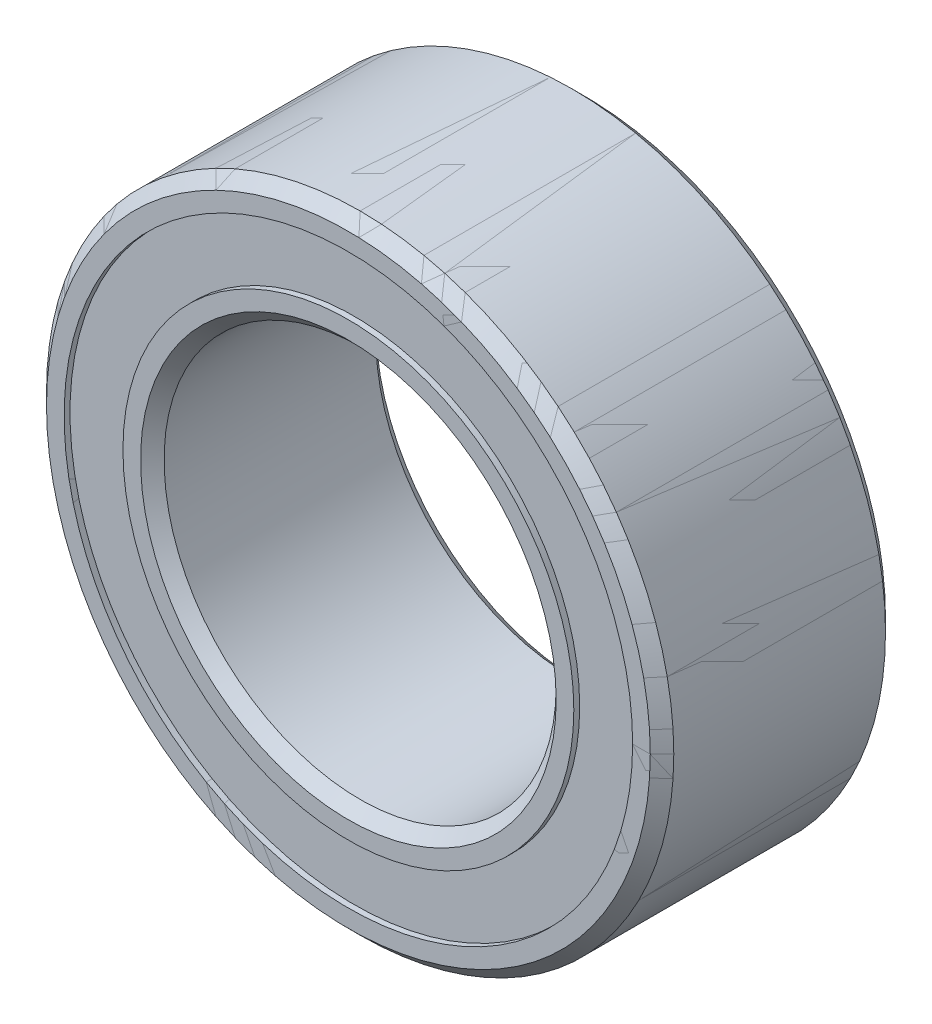
from build123d import *

# Parameters (mm, degrees)
CHAMFER1_SIZE     = 0.15
CIRPATTERN1_COUNT = 11
SKETCH5_W         = 0.925
SKETCH5_H         = 0.75


with BuildPart() as part:
    # Sketch8 → Revolve1 (revolve)
    with BuildSketch(Plane(origin=(0, 0, 0), x_dir=(0, 0, -1), z_dir=(1, 0, 0))):
        with BuildLine():
            Line((1.5, 4), (-1.5, 4))
            Line((-1.5, 4), (-1.5, 3.625))
            Line((-1.5, 3.625), (-0.330718914, 3.625))
            ThreePointArc((-0.330718914, 3.625), (0, 3.75), (0.330718914, 3.625))
            Line((0.330718914, 3.625), (1.5, 3.625))
            Line((1.5, 3.625), (1.5, 4))
        make_face()
    revolve(axis=Axis((0, 0, 1.5), (0, 0, -1)))

    # Chamfer1
    chamfer1_edges = [part.edges().sort_by_distance(p)[0] for p in [
        (0, -4, -1.5),
        (0, -4, 1.5),
    ]]
    chamfer(chamfer1_edges, length=CHAMFER1_SIZE)


with BuildPart() as body_2:
    # Sketch2 → Revolve2 (revolve)
    with BuildSketch(Plane(origin=(0, 0, 0), x_dir=(0, 0, -1), z_dir=(1, 0, 0))):
        with BuildLine():
            Line((-0.330718914, 3.625), (-1.5, 3.625))
            Line((-1.5, 3.625), (-1.5, 3.85))
            Line((-1.5, 3.85), (-1.35, 4))
            Line((-1.35, 4), (1.35, 4))
            Line((1.35, 4), (1.5, 3.85))
            Line((1.5, 3.85), (1.5, 3.625))
            Line((1.5, 3.625), (0.330718914, 3.625))
            ThreePointArc((0.330718914, 3.625), (0, 3.75), (-0.330718914, 3.625))
        make_face()
        with BuildLine():
            Line((1.5, 2.875), (0.330718914, 2.875))
            ThreePointArc((0.330718914, 2.875), (0, 2.75), (-0.330718914, 2.875))
            Line((-0.330718914, 2.875), (-1.5, 2.875))
            Line((-1.5, 2.875), (-1.5, 2.65))
            Line((-1.5, 2.65), (-1.35, 2.5))
            Line((-1.35, 2.5), (1.35, 2.5))
            Line((1.35, 2.5), (1.5, 2.65))
            Line((1.5, 2.65), (1.5, 2.875))
        make_face()
    revolve(axis=Axis((0, 0, 1.5), (0, 0, -1)))


with BuildPart() as body_3:
    # Sketch3 → Revolve3 (revolve)
    with BuildSketch(Plane(origin=(0, 0, 0), x_dir=(0, 0, -1), z_dir=(1, 0, 0))):
        with BuildLine():
            Line((-0.5, 3.25), (0.5, 3.25))
            ThreePointArc((0.5, 3.25), (0, 3.75), (-0.5, 3.25))
        make_face()
    revolve(axis=Axis((0, 3.25, 0.5), (0, 0, -1)))


with BuildPart() as cirpattern1_1:
    # CirPattern1: pattern copy
    add(body_3.part.rotate(Axis((0, 0, -1.5), (0, 0, 1)), 1 * 360 / CIRPATTERN1_COUNT))


with BuildPart() as cirpattern1_2:
    # CirPattern1: pattern copy
    add(body_3.part.rotate(Axis((0, 0, -1.5), (0, 0, 1)), 2 * 360 / CIRPATTERN1_COUNT))


with BuildPart() as cirpattern1_3:
    # CirPattern1: pattern copy
    add(body_3.part.rotate(Axis((0, 0, -1.5), (0, 0, 1)), 3 * 360 / CIRPATTERN1_COUNT))


with BuildPart() as cirpattern1_4:
    # CirPattern1: pattern copy
    add(body_3.part.rotate(Axis((0, 0, -1.5), (0, 0, 1)), 4 * 360 / CIRPATTERN1_COUNT))


with BuildPart() as cirpattern1_5:
    # CirPattern1: pattern copy
    add(body_3.part.rotate(Axis((0, 0, -1.5), (0, 0, 1)), 5 * 360 / CIRPATTERN1_COUNT))


with BuildPart() as cirpattern1_6:
    # CirPattern1: pattern copy
    add(body_3.part.rotate(Axis((0, 0, -1.5), (0, 0, 1)), 6 * 360 / CIRPATTERN1_COUNT))


with BuildPart() as cirpattern1_7:
    # CirPattern1: pattern copy
    add(body_3.part.rotate(Axis((0, 0, -1.5), (0, 0, 1)), 7 * 360 / CIRPATTERN1_COUNT))


with BuildPart() as cirpattern1_8:
    # CirPattern1: pattern copy
    add(body_3.part.rotate(Axis((0, 0, -1.5), (0, 0, 1)), 8 * 360 / CIRPATTERN1_COUNT))


with BuildPart() as cirpattern1_9:
    # CirPattern1: pattern copy
    add(body_3.part.rotate(Axis((0, 0, -1.5), (0, 0, 1)), 9 * 360 / CIRPATTERN1_COUNT))


with BuildPart() as cirpattern1_10:
    # CirPattern1: pattern copy
    add(body_3.part.rotate(Axis((0, 0, -1.5), (0, 0, 1)), 10 * 360 / CIRPATTERN1_COUNT))


with BuildPart() as body_14:
    # Sketch5 → Revolve5 (revolve)
    with BuildSketch(Plane(origin=(0, 0, 0), x_dir=(0, 0, -1), z_dir=(1, 0, 0))):
        with Locations((-0.9625, 3.25)):
            Rectangle(SKETCH5_W, SKETCH5_H)
        with Locations((0.9625, 3.25)):
            Rectangle(SKETCH5_W, SKETCH5_H)
    revolve(axis=Axis((0, 0, 1.5), (0, 0, -1)))


solid = Compound([part.part, body_2.part, body_3.part, cirpattern1_1.part, cirpattern1_2.part, cirpattern1_3.part, cirpattern1_4.part, cirpattern1_5.part, cirpattern1_6.part, cirpattern1_7.part, cirpattern1_8.part, cirpattern1_9.part, cirpattern1_10.part, body_14.part])
